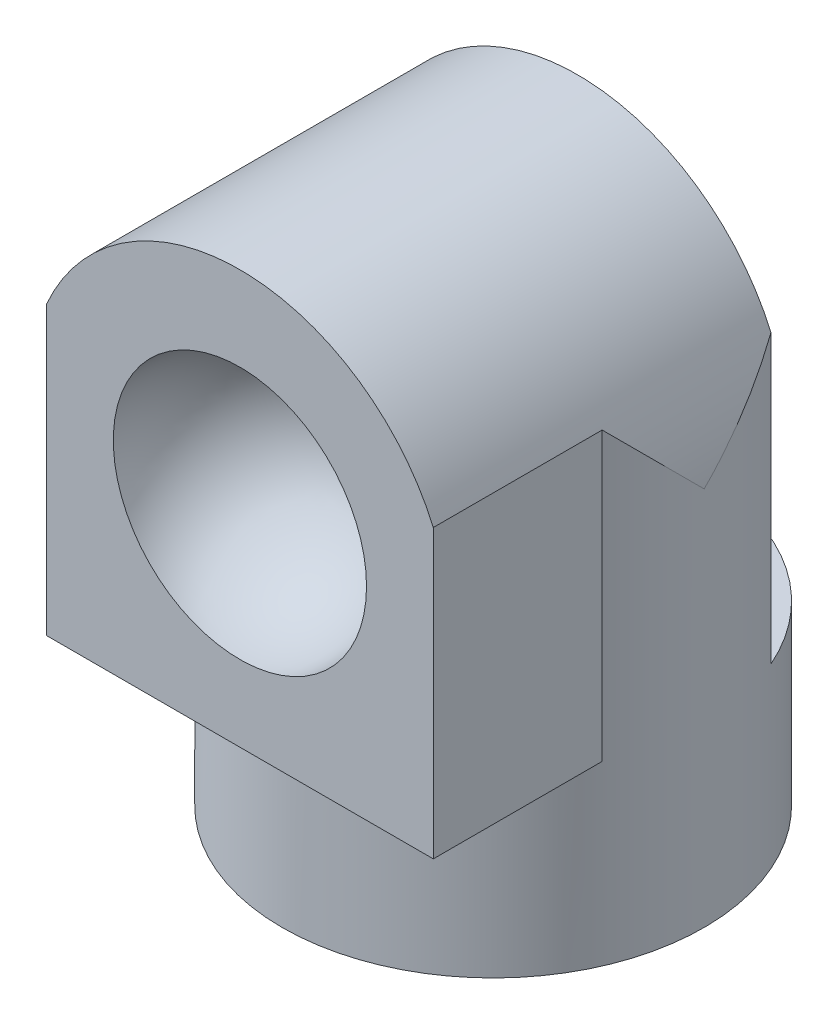
from build123d import *

# Parameters (mm, degrees)
SKETCH1_R           = 2.5
SKETCH1_R_2         = 1
BOSS_EXTRUDE2_DEPTH = 2.1
BOSS_EXTRUDE3_DEPTH = 1
SKETCH4_R           = 1
CUT_EXTRUDE13_DEPTH = 2
SKETCH6_OUTSIDE_W   = 8.99
SKETCH6_OUTSIDE_H   = 8.99
SKETCH6_OUTSIDE_R   = 2.5
CUT_EXTRUDE14_DEPTH = 8.842193571
BOSS_EXTRUDE4_START = 2
BOSS_EXTRUDE4_DEPTH = 2


with BuildPart() as part:
    # Sketch1 → Boss-Extrude2 (new body)
    with BuildSketch(Plane(origin=(0, 0, 0), x_dir=(1, 0, 0), z_dir=(0, 1, 0))):
        with Locations(Location((0, 0, 0), (0, 0, 270))):
            Circle(SKETCH1_R)
        with Locations(Location((0, 0, 0), (0, 0, 270))):
            Circle(SKETCH1_R_2, mode=Mode.SUBTRACT)
    extrude(amount=BOSS_EXTRUDE2_DEPTH)

    # Sketch2 → Boss-Extrude3 (add, symmetric)
    with BuildSketch(Plane.XY):
        with BuildLine():
            Line((2.5, 4.5), (2.5, 0))
            Line((2.5, 0), (-2.5, 0))
            Line((-2.5, 0), (-2.5, 4.5))
            ThreePointArc((-2.5, 4.5), (0, 7), (2.5, 4.5))
        make_face()
    extrude(amount=BOSS_EXTRUDE3_DEPTH, both=True)

    # Sketch4 → Cut-Extrude13 (cut)
    with BuildSketch(Plane.XZ):
        with Locations(Location((0, 0, 0), (0, 0, 270))):
            Circle(SKETCH4_R)
    extrude(amount=-CUT_EXTRUDE13_DEPTH, mode=Mode.SUBTRACT)

    # Sketch6 outside → Cut-Extrude14 (cut, through all)
    with BuildSketch(Plane.XZ):
        Rectangle(SKETCH6_OUTSIDE_W, SKETCH6_OUTSIDE_H)
        with Locations(Location((0, 0, 0), (0, 0, 336.421821522))):
            Circle(SKETCH6_OUTSIDE_R, mode=Mode.SUBTRACT)
    extrude(amount=-CUT_EXTRUDE14_DEPTH, mode=Mode.SUBTRACT)

    # Sketch7 → Boss-Extrude4 (add)
    with BuildSketch(Plane.XY.offset(1).offset(BOSS_EXTRUDE4_START)):
        with BuildLine():
            Line((2.291287847, 2.1), (2.291287847, 5.5))
            ThreePointArc((2.291287847, 5.5), (0, 7), (-2.291287847, 5.5))
            Line((-2.291287847, 5.5), (-2.291287847, 2.1))
            Line((-2.291287847, 2.1), (2.291287847, 2.1))
        make_face()
    extrude(amount=-BOSS_EXTRUDE4_DEPTH)

    # Sketch9 → Cut-Revolve1 (revolve, cut)
    with BuildSketch(Plane.XY.offset(3)):
        with BuildLine():
            Line((-1.5, 4.5), (1.5, 4.5))
            ThreePointArc((1.5, 4.5), (0, 6), (-1.5, 4.5))
        make_face()
    revolve(axis=Axis((-1.5, 4.5, 3), (1, 0, 0)), mode=Mode.SUBTRACT)


solid = part.part
